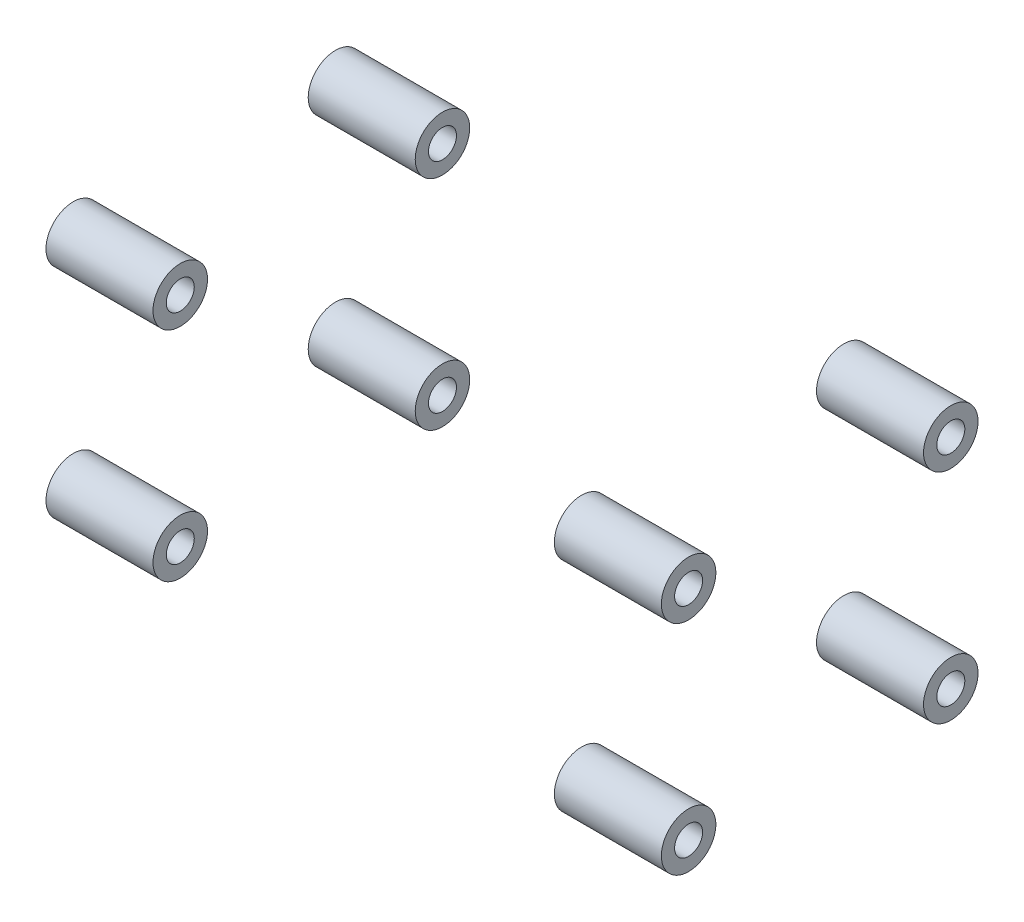
from build123d import *

# Parameters (mm, degrees)
BOSS_EXTRUDE2_START   = 23.38
SKETCH2_R             = 3.175
SKETCH2_R_2           = 1.63195
BOSS_EXTRUDE2_DEPTH   = 12.469999952
BOSS_EXTRUDE2_2_DEPTH = 12.469999952
BOSS_EXTRUDE2_3_DEPTH = 12.469999952
BOSS_EXTRUDE2_4_DEPTH = 12.469999952


with BuildPart() as part:
    # Sketch2 → Boss-Extrude2 (new body)
    with BuildSketch(Plane(origin=(0, 0, 0), x_dir=(0, 0, -1), z_dir=(1, 0, 0)).offset(BOSS_EXTRUDE2_START)):
        with Locations(Location((-40.279022884, 12.7, 0), (0, 0, 180))):
            Circle(SKETCH2_R)
        with Locations(Location((-40.279022884, 12.7, 0), (0, 0, 180))):
            Circle(SKETCH2_R_2, mode=Mode.SUBTRACT)
    extrude(amount=BOSS_EXTRUDE2_DEPTH)


with BuildPart() as body_2:
    # Sketch2 → Boss-Extrude2 2 (new body)
    with BuildSketch(Plane(origin=(0, 0, 0), x_dir=(0, 0, -1), z_dir=(1, 0, 0)).offset(BOSS_EXTRUDE2_START)):
        with Locations(Location((-40.279022884, -12.7, 0), (0, 0, 180))):
            Circle(SKETCH2_R)
        with Locations(Location((-40.279022884, -12.7, 0), (0, 0, 180))):
            Circle(SKETCH2_R_2, mode=Mode.SUBTRACT)
    extrude(amount=BOSS_EXTRUDE2_2_DEPTH)


with BuildPart() as body_3:
    # Sketch2 → Boss-Extrude2 3 (new body)
    with BuildSketch(Plane(origin=(0, 0, 0), x_dir=(0, 0, -1), z_dir=(1, 0, 0)).offset(BOSS_EXTRUDE2_START)):
        with Locations(Location((-9.727227116, -12.7, 0), (0, 0, 180))):
            Circle(SKETCH2_R)
        with Locations(Location((-9.727227116, -12.7, 0), (0, 0, 180))):
            Circle(SKETCH2_R_2, mode=Mode.SUBTRACT)
    extrude(amount=BOSS_EXTRUDE2_3_DEPTH)


with BuildPart() as body_4:
    # Sketch2 → Boss-Extrude2 4 (new body)
    with BuildSketch(Plane(origin=(0, 0, 0), x_dir=(0, 0, -1), z_dir=(1, 0, 0)).offset(BOSS_EXTRUDE2_START)):
        with Locations(Location((-9.727227116, 12.7, 0), (0, 0, 180))):
            Circle(SKETCH2_R)
        with Locations(Location((-9.727227116, 12.7, 0), (0, 0, 180))):
            Circle(SKETCH2_R_2, mode=Mode.SUBTRACT)
    extrude(amount=BOSS_EXTRUDE2_4_DEPTH)


with BuildPart() as body_5:
    # Mirror2: mirrored copy
    add(body_4.part.mirror(Plane(origin=(0, 0, 0), x_dir=(0, 0, 1), z_dir=(1, 0, 0))))


with BuildPart() as body_6:
    # Mirror2 2: mirrored copy
    add(part.part.mirror(Plane(origin=(0, 0, 0), x_dir=(0, 0, 1), z_dir=(1, 0, 0))))


with BuildPart() as body_7:
    # Mirror2 3: mirrored copy
    add(body_2.part.mirror(Plane(origin=(0, 0, 0), x_dir=(0, 0, 1), z_dir=(1, 0, 0))))


with BuildPart() as body_8:
    # Mirror2 4: mirrored copy
    add(body_3.part.mirror(Plane(origin=(0, 0, 0), x_dir=(0, 0, 1), z_dir=(1, 0, 0))))


solid = Compound([part.part, body_2.part, body_3.part, body_4.part, body_5.part, body_6.part, body_7.part, body_8.part])
